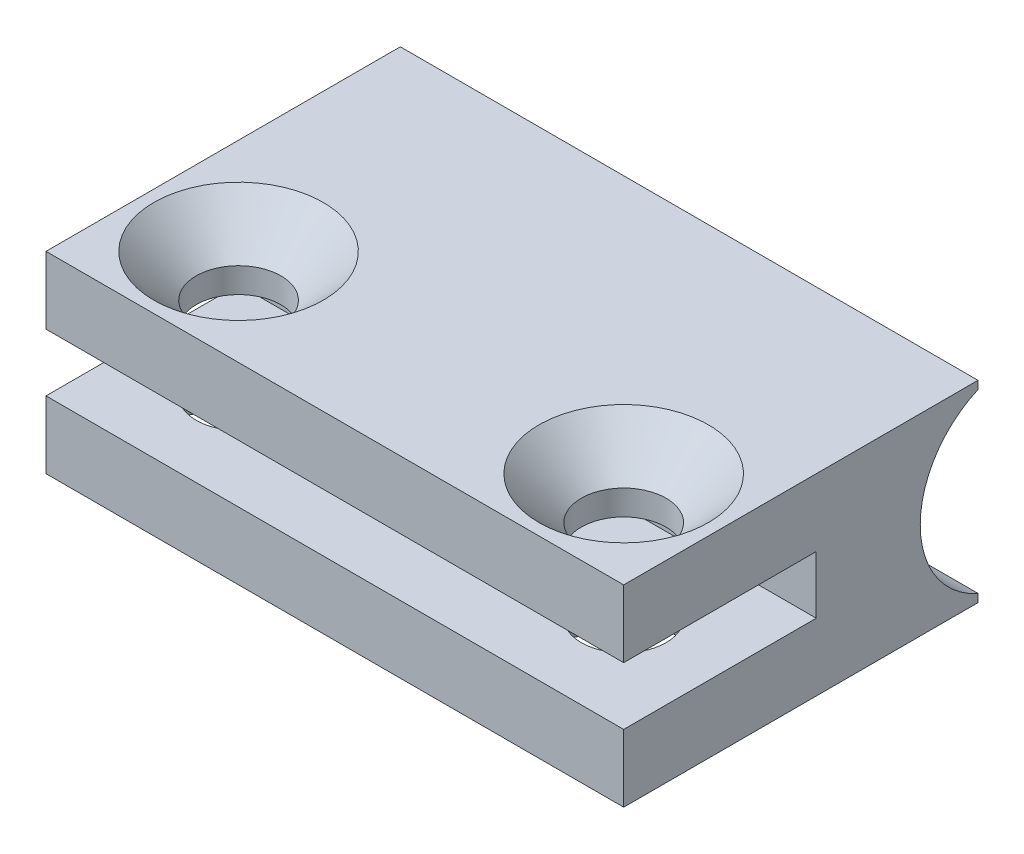
from build123d import *

# Parameters (mm, degrees)
EXTRUDE_1_DEPTH             = 15
SKETCH_2_W                  = 1
SKETCH_2_H                  = 1
CUT_EXTRUDE_1_DEPTH         = 15
HOLE_WIZARD_M21_D           = 2.2
HOLE_WIZARD_M21_CSINK_D     = 4.4
HOLE_WIZARD_M21_CSINK_ANGLE = 90
CUT_EXTRUDE_2_DEPTH         = 1.2


with BuildPart() as part:
    # Эскиз1 → Бобышка-Вытянуть1 (new body)
    with BuildSketch(Plane(origin=(0, 0, 0), x_dir=(0, 0, -1), z_dir=(1, 0, 0))):
        with BuildLine():
            ThreePointArc((10.2, 2.5), (7.7, 0), (10.2, -2.5))
            Line((10.2, -2.5), (0, -2.5))
            Line((0, -2.5), (0, -0.75))
            Line((0, -0.75), (5, -0.75))
            Line((5, -0.75), (5, 0.75))
            Line((5, 0.75), (0, 0.75))
            Line((0, 0.75), (0, 2.5))
            Line((0, 2.5), (10.2, 2.5))
        make_face()
    extrude(amount=EXTRUDE_1_DEPTH)

    # Эскиз2 → Вырез-Вытянуть1 (cut)
    with BuildSketch(Plane(origin=(15, 0, 0), x_dir=(0, 0, -1), z_dir=(1, 0, 0))):
        with Locations((9.7, 2)):
            Rectangle(SKETCH_2_W, SKETCH_2_H)
        with Locations((9.7, -2)):
            Rectangle(SKETCH_2_W, SKETCH_2_H)
    extrude(amount=-CUT_EXTRUDE_1_DEPTH, mode=Mode.SUBTRACT)

    # Зенковка для винта с полупотайной головкой M21 (through all)
    with Locations(Plane(origin=(0, 2.5, 0), x_dir=(1, 0, 0), z_dir=(0, 1, 0))):
        with Locations((12.5, 2.5), (2.5, 2.5)):
            CounterSinkHole(HOLE_WIZARD_M21_D / 2, HOLE_WIZARD_M21_CSINK_D / 2, counter_sink_angle=HOLE_WIZARD_M21_CSINK_ANGLE)

    # Эскиз5 → Вырез-Вытянуть2 (cut)
    with BuildSketch(Plane.XZ.offset(2.5)):
        Polygon((1.321132129, -0.458141777), (0.142264973, -2.500000412), (1.321132843, -4.541858635), (3.678867871, -4.541858223), (4.857735027, -2.499999588), (3.678867157, -0.458141365), align=None)
        Polygon((13.678867157, -4.541858635), (11.321132129, -4.541858223), (10.142264973, -2.499999588), (11.321132843, -0.458141365), (13.678867871, -0.458141777), (14.857735027, -2.500000412), align=None)
    extrude(amount=-CUT_EXTRUDE_2_DEPTH, mode=Mode.SUBTRACT)


solid = part.part
